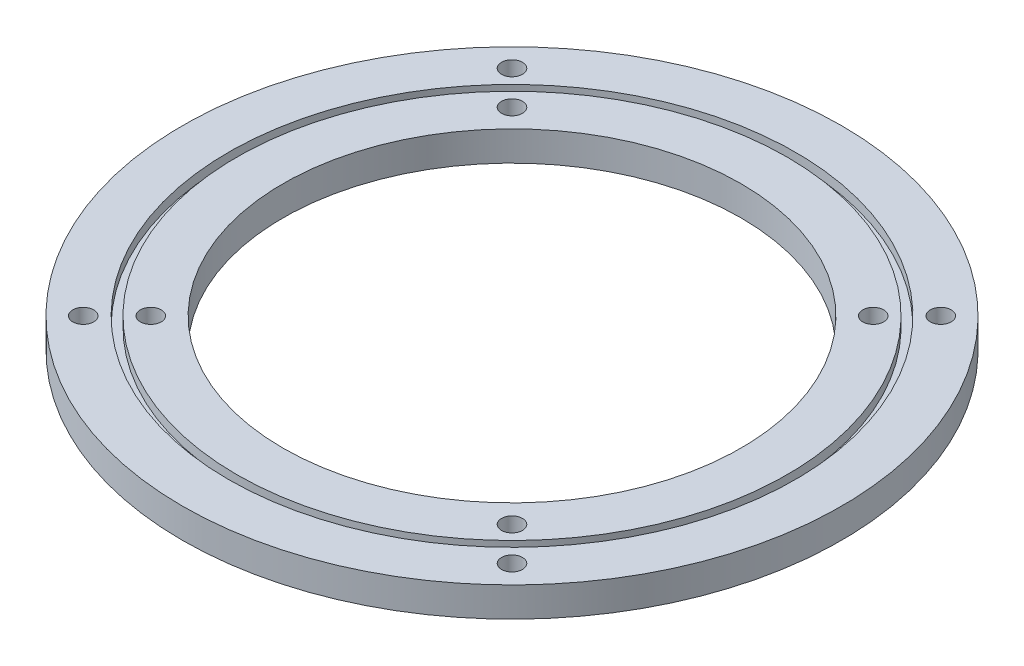
from build123d import *

# Parameters (mm, degrees)
SKETCH1_R             = 100
SKETCH1_R_2           = 3.175
SKETCH1_R_3           = 86.02
BOSS_EXTRUDE1_DEPTH   = 4.5
SKETCH1_R_4           = 83.48
SKETCH1_R_5           = 69.5
BOSS_EXTRUDE1_2_DEPTH = 4.5
SKETCH1_3_R           = 86.02
SKETCH1_3_R_2         = 83.48
BOSS_EXTRUDE2_DEPTH   = 1.5875


with BuildPart() as part:
    # Sketch1 → Boss-Extrude1 (new, symmetric)
    with BuildSketch(Plane(origin=(0, 0, 0), x_dir=(1, 0, 0), z_dir=(0, 1, 0))):
        Circle(SKETCH1_R)
        with Locations((-65.053823869, -65.053823869)):
            Circle(SKETCH1_R_2, mode=Mode.SUBTRACT)
        with Locations((65.053823869, -65.053823869)):
            Circle(SKETCH1_R_2, mode=Mode.SUBTRACT)
        with Locations((-65.053823869, 65.053823869)):
            Circle(SKETCH1_R_2, mode=Mode.SUBTRACT)
        Circle(SKETCH1_R_3, mode=Mode.SUBTRACT)
        with Locations((65.053823869, 65.053823869)):
            Circle(SKETCH1_R_2, mode=Mode.SUBTRACT)
    extrude(amount=BOSS_EXTRUDE1_DEPTH, both=True)



with BuildPart() as body_2:
    # Sketch1 → Boss-Extrude1 2 (new, symmetric)
    with BuildSketch(Plane(origin=(0, 0, 0), x_dir=(1, 0, 0), z_dir=(0, 1, 0))):
        Circle(SKETCH1_R_4)
        with Locations((-54.800775542, -54.800775542)):
            Circle(SKETCH1_R_2, mode=Mode.SUBTRACT)
        with Locations((54.800775542, -54.800775542)):
            Circle(SKETCH1_R_2, mode=Mode.SUBTRACT)
        with Locations((-54.800775542, 54.800775542)):
            Circle(SKETCH1_R_2, mode=Mode.SUBTRACT)
        Circle(SKETCH1_R_5, mode=Mode.SUBTRACT)
        with Locations((54.800775542, 54.800775542)):
            Circle(SKETCH1_R_2, mode=Mode.SUBTRACT)
    extrude(amount=BOSS_EXTRUDE1_2_DEPTH, both=True)


with BuildPart() as part_1:
    add(part.part)

    add(body_2.part)  # Boss-Extrude2 merges body 2
    # Sketch1<3> → Boss-Extrude2 (add, symmetric)
    with BuildSketch(Plane(origin=(0, 0, 0), x_dir=(1, 0, 0), z_dir=(0, 1, 0))):
        Circle(SKETCH1_3_R)
        Circle(SKETCH1_3_R_2, mode=Mode.SUBTRACT)
    extrude(amount=BOSS_EXTRUDE2_DEPTH, both=True)


solid = part_1.part
